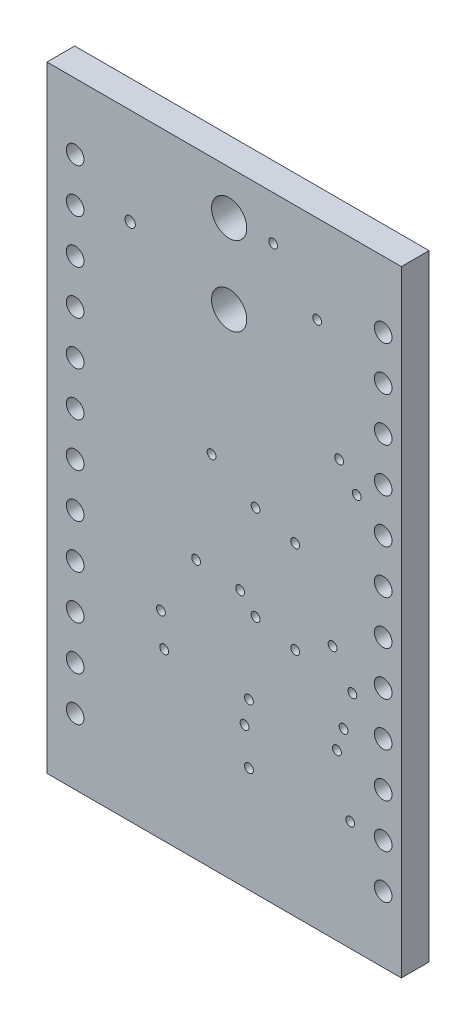
from build123d import *

# Parameters (mm, degrees)
BOARD_OUTLINE_DEPTH = 1.6
SKETCH2_R           = 1.016
SKETCH2_R_2         = 1.651
SKETCH2_R_3         = 0.254
SKETCH2_R_4         = 0.3
NPTH_DEPTH          = 55.024838732
SKETCH3_R           = 0.51
PTH_DEPTH           = 55.024838732
SKETCH4_W           = 11.674517828
SKETCH4_H           = 37.265337661
CUT_EXTRUDE1_DEPTH  = 10
SKETCH6_W           = 12.562793993
SKETCH6_H           = 36.934833376
CUT_EXTRUDE2_DEPTH  = 10


with BuildPart() as part:
    # Sketch1 → Board_Outline (new body)
    with BuildSketch(Plane.XY):
        Polygon((2.54, 35.56), (38.1, 35.56), (38.7574, 35.473452), (39.37, 35.219705), (39.896051, 34.816051), (40.299705, 34.29), (40.553452, 33.6774), (40.64, 33.02), (40.64, 2.54), (40.553452, 1.8826), (40.299705, 1.27), (39.896051, 0.743949), (39.37, 0.340295), (38.7574, 0.086548), (38.1, 0), (2.54, 0), (1.8826, 0.086548), (1.27, 0.340295), (0.743949, 0.743949), (0.340295, 1.27), (0.086548, 1.8826), (0, 2.54), (0, 33.02), (0.086548, 33.6774), (0.340295, 34.29), (0.743949, 34.816051), (1.27, 35.219705), (1.8826, 35.473452), align=None)
    extrude(amount=BOARD_OUTLINE_DEPTH)

    # Sketch2 → NPTH (cut, through all)
    with BuildSketch(Plane.XY):
        with Locations((20.32, 33.02)):
            Circle(SKETCH2_R)
        with Locations((20.32, 28.448)):
            Circle(SKETCH2_R)
        with Locations((2.54, 33.02)):
            Circle(SKETCH2_R_2)
        with Locations((38.1, 33.02)):
            Circle(SKETCH2_R_2)
        with Locations((2.54, 2.54)):
            Circle(SKETCH2_R_2)
        with Locations((38.1, 2.54)):
            Circle(SKETCH2_R_2)
        with Locations((21.463, 9.525)):
            Circle(SKETCH2_R_3)
        with Locations((27.686, 22.86)):
            Circle(SKETCH2_R_3)
        with Locations((20.955, 14.732)):
            Circle(SKETCH2_R_3)
        with Locations((24.13, 13.335)):
            Circle(SKETCH2_R_3)
        with Locations((24.13, 18.669)):
            Circle(SKETCH2_R_3)
        with Locations((19.304, 20.701)):
            Circle(SKETCH2_R_3)
        with Locations((18.415, 14.986)):
            Circle(SKETCH2_R_3)
        with Locations((16.383, 11.43)):
            Circle(SKETCH2_R_3)
        with Locations((16.571, 9.591)):
            Circle(SKETCH2_R_3)
        with Locations((26.67, 24.13)):
            Circle(SKETCH2_R_3)
        with Locations((26.543, 9.525)):
            Circle(SKETCH2_R_3)
        with Locations((26.924, 10.795)):
            Circle(SKETCH2_R_3)
        with Locations((26.289, 14.605)):
            Circle(SKETCH2_R_3)
        with Locations((21.463, 6.096)):
            Circle(SKETCH2_R_3)
        with Locations((14.605, 29.972)):
            Circle(SKETCH2_R_4)
        with Locations((21.209, 8.128)):
            Circle(SKETCH2_R_3)
        with Locations((27.305, 6.35)):
            Circle(SKETCH2_R_3)
        with Locations((27.432, 12.827)):
            Circle(SKETCH2_R_3)
        with Locations((21.844, 19.304)):
            Circle(SKETCH2_R_3)
        with Locations((21.844, 13.843)):
            Circle(SKETCH2_R_3)
        with Locations((25.4, 30.48)):
            Circle(SKETCH2_R_3)
        with Locations((22.86, 33.02)):
            Circle(SKETCH2_R_3)
    extrude(amount=NPTH_DEPTH, mode=Mode.SUBTRACT)

    # Sketch3 → PTH (cut, through all)
    with BuildSketch(Plane.XY):
        with Locations((11.43, 31.75)):
            Circle(SKETCH3_R)
        with Locations((11.43, 29.21)):
            Circle(SKETCH3_R)
        with Locations((11.43, 26.67)):
            Circle(SKETCH3_R)
        with Locations((34.29, 31.75)):
            Circle(SKETCH3_R)
        with Locations((11.43, 24.13)):
            Circle(SKETCH3_R)
        with Locations((11.43, 21.59)):
            Circle(SKETCH3_R)
        with Locations((11.43, 19.05)):
            Circle(SKETCH3_R)
        with Locations((11.43, 16.51)):
            Circle(SKETCH3_R)
        with Locations((11.43, 13.97)):
            Circle(SKETCH3_R)
        with Locations((11.43, 11.43)):
            Circle(SKETCH3_R)
        with Locations((11.43, 8.89)):
            Circle(SKETCH3_R)
        with Locations((11.43, 6.35)):
            Circle(SKETCH3_R)
        with Locations((11.43, 3.81)):
            Circle(SKETCH3_R)
        with Locations((29.21, 3.81)):
            Circle(SKETCH3_R)
        with Locations((29.21, 6.35)):
            Circle(SKETCH3_R)
        with Locations((29.21, 8.89)):
            Circle(SKETCH3_R)
        with Locations((29.21, 11.43)):
            Circle(SKETCH3_R)
        with Locations((29.21, 13.97)):
            Circle(SKETCH3_R)
        with Locations((29.21, 16.51)):
            Circle(SKETCH3_R)
        with Locations((29.21, 19.05)):
            Circle(SKETCH3_R)
        with Locations((29.21, 21.59)):
            Circle(SKETCH3_R)
        with Locations((29.21, 24.13)):
            Circle(SKETCH3_R)
        with Locations((29.21, 26.67)):
            Circle(SKETCH3_R)
        with Locations((29.21, 29.21)):
            Circle(SKETCH3_R)
        with Locations((29.21, 31.75)):
            Circle(SKETCH3_R)
        with Locations((6.35, 3.81)):
            Circle(SKETCH3_R)
        with Locations((6.35, 6.35)):
            Circle(SKETCH3_R)
        with Locations((6.35, 8.89)):
            Circle(SKETCH3_R)
        with Locations((6.35, 11.43)):
            Circle(SKETCH3_R)
        with Locations((6.35, 13.97)):
            Circle(SKETCH3_R)
        with Locations((6.35, 16.51)):
            Circle(SKETCH3_R)
        with Locations((34.29, 3.81)):
            Circle(SKETCH3_R)
        with Locations((34.29, 6.35)):
            Circle(SKETCH3_R)
        with Locations((34.29, 8.89)):
            Circle(SKETCH3_R)
        with Locations((34.29, 11.43)):
            Circle(SKETCH3_R)
        with Locations((34.29, 13.97)):
            Circle(SKETCH3_R)
        with Locations((34.29, 16.51)):
            Circle(SKETCH3_R)
        with Locations((34.29, 19.05)):
            Circle(SKETCH3_R)
        with Locations((34.29, 21.59)):
            Circle(SKETCH3_R)
        with Locations((6.35, 19.05)):
            Circle(SKETCH3_R)
        with Locations((6.35, 29.21)):
            Circle(SKETCH3_R)
        with Locations((34.29, 24.13)):
            Circle(SKETCH3_R)
        with Locations((34.29, 29.21)):
            Circle(SKETCH3_R)
        with Locations((6.35, 24.13)):
            Circle(SKETCH3_R)
        with Locations((6.35, 26.67)):
            Circle(SKETCH3_R)
        with Locations((34.29, 26.67)):
            Circle(SKETCH3_R)
        with Locations((6.35, 31.75)):
            Circle(SKETCH3_R)
        with Locations((6.35, 21.59)):
            Circle(SKETCH3_R)
    extrude(amount=PTH_DEPTH, mode=Mode.SUBTRACT)

    # Sketch4 → Cut-Extrude1 (cut)
    with BuildSketch(Plane.XY.offset(1.6)):
        with Locations((3.966399383, 16.92733117)):
            Rectangle(SKETCH4_W, SKETCH4_H)
    extrude(amount=-CUT_EXTRUDE1_DEPTH, mode=Mode.SUBTRACT)

    # Sketch6 → Cut-Extrude2 (cut)
    with BuildSketch(Plane(origin=(0, 0, 0), x_dir=(-1, 0, 0), z_dir=(0, 0, -1))):
        with Locations((-36.539437357, 18.467416688)):
            Rectangle(SKETCH6_W, SKETCH6_H)
    extrude(amount=-CUT_EXTRUDE2_DEPTH, mode=Mode.SUBTRACT)


solid = part.part
